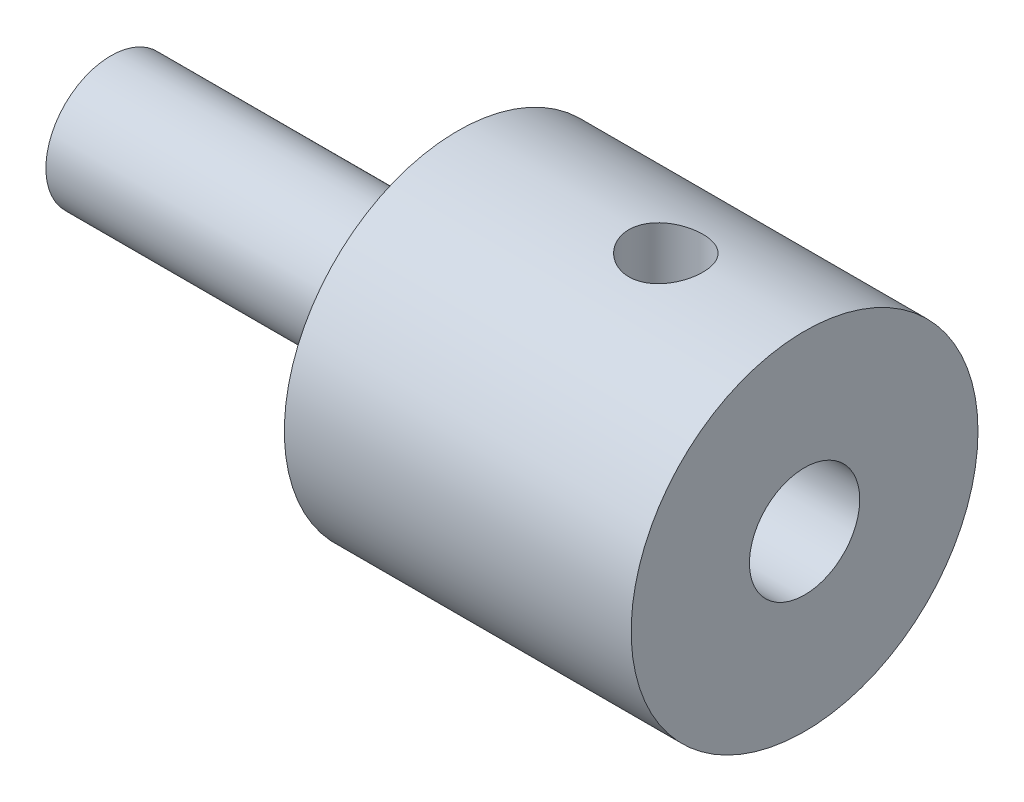
from build123d import *

# Parameters (mm, degrees)
SKETCH1_R                       = 6.35
BOSS_EXTRUDE1_DEPTH             = 25.4
F_21_0_159_DIAMETER_HOLE1_D     = 4.0386
F_21_0_159_DIAMETER_HOLE1_DEPTH = 9.0000074
F_21_0_159_DIAMETER_HOLE1_TIP   = 1.213317848
SKETCH5_W                       = 1.35255
SKETCH5_H                       = 6.35
SKETCH7_W                       = 12.7
SKETCH7_H                       = 3.96875


with BuildPart() as part:
    # Sketch1 → Boss-Extrude1 (new body)
    with BuildSketch(Plane(origin=(0, 0, 0), x_dir=(0, 0, -1), z_dir=(1, 0, 0))):
        Circle(SKETCH1_R)
    extrude(amount=BOSS_EXTRUDE1_DEPTH)

    # #21 (0.159) Diameter Hole1
    with Locations(Plane(origin=(25.4, 0, 0), x_dir=(0, 0, -1), z_dir=(1, 0, 0))):
        with Locations((0, 0)):
            Hole(F_21_0_159_DIAMETER_HOLE1_D / 2, depth=F_21_0_159_DIAMETER_HOLE1_DEPTH)
            with Locations((0, 0, -(F_21_0_159_DIAMETER_HOLE1_DEPTH + F_21_0_159_DIAMETER_HOLE1_TIP / 2))):  # 118° drill point
                Cone(0, F_21_0_159_DIAMETER_HOLE1_D / 2, F_21_0_159_DIAMETER_HOLE1_TIP, mode=Mode.SUBTRACT)

    # Sketch5 → #6-32 Tapped Hole1 (revolve, cut)
    with BuildSketch(Plane(origin=(20.32, 0, 0), x_dir=(0, 0, -1), z_dir=(1, 0, 0))):
        with Locations((0.676275, 3.175)):
            Rectangle(SKETCH5_W, SKETCH5_H)
    revolve(axis=Axis((20.32, -6.35, 0), (0, 1, 0)), mode=Mode.SUBTRACT)

    # Sketch7 → Cut-Revolve1 (revolve, cut)
    with BuildSketch(Plane(origin=(0, 0, 0), x_dir=(1, 0, 0), z_dir=(0, 1, 0))):
        with Locations((6.35, 4.365625)):
            Rectangle(SKETCH7_W, SKETCH7_H)
    revolve(axis=Axis((25.4, 0, 0), (-1, 0, 0)), mode=Mode.SUBTRACT)


solid = part.part
